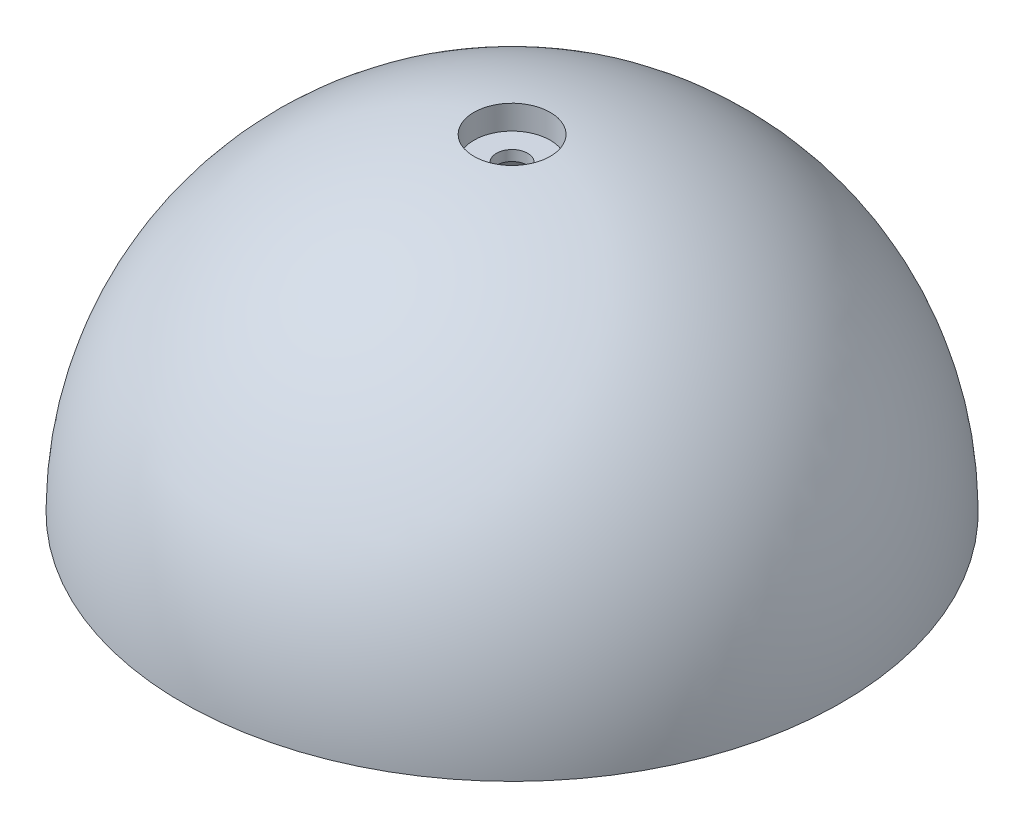
from build123d import *

# Parameters (mm, degrees)
SKETCH2_W              = 242.645613954
SKETCH2_H              = 231.138030636
CUT_IN_HALF_DEPTH      = 165.544826719
SKETCH3_R              = 11
BALLBEARINGHOLE_DEPTH  = 165.544826719
SKETCH4_R              = 31.202879122
SUPPORTFORHOLE_DEPTH   = 4
F_2NDBEARINGHOLE_START = -7
SKETCH5_R              = 11
F_2NDBEARINGHOLE_DEPTH = 7
SKETCH6_R              = 4.5
INSIDEHOLE_DEPTH       = 161.277134988


with BuildPart() as part:
    # Half Circle → Sphere Revolve (revolve)
    with BuildSketch(Plane.XY):
        with BuildLine():
            Line((0, 85), (0, 95))
            ThreePointArc((0, 95), (-95, 0), (0, -95))
            Line((0, -95), (0, -85))
            ThreePointArc((0, -85), (-85, 0), (0, 85))
        make_face()
    revolve(axis=Axis((0, 85, 0), (0, 1, 0)))

    # Sketch2 → Cut in Half (cut, through all)
    with BuildSketch(Plane(origin=(0, 0, 0), x_dir=(1, 0, 0), z_dir=(0, 1, 0))):
        Rectangle(SKETCH2_W, SKETCH2_H)
    extrude(amount=-CUT_IN_HALF_DEPTH, mode=Mode.SUBTRACT)

    # Sketch3 → BallBearingHole (cut, through all)
    with BuildSketch(Plane(origin=(0, 0, 0), x_dir=(1, 0, 0), z_dir=(0, 1, 0))):
        with Locations(Location((0, 0, 0), (0, 0, 90))):
            Circle(SKETCH3_R)
    extrude(amount=BALLBEARINGHOLE_DEPTH, mode=Mode.SUBTRACT)

    # Sketch4 → SupportForHole (add)
    with BuildSketch(Plane(origin=(0, 84.4, 0), x_dir=(1, 0, 0), z_dir=(0, 1, 0))):
        Circle(SKETCH4_R)
    extrude(amount=SUPPORTFORHOLE_DEPTH)

    # Sketch5 → 2ndBearingHole (cut)
    with BuildSketch(Plane(origin=(0, 94.4, 0), x_dir=(1, 0, 0), z_dir=(0, 1, 0)).offset(F_2NDBEARINGHOLE_START)):
        with Locations(Location((0, 0, 0), (0, 0, 90))):
            Circle(SKETCH5_R)
    extrude(amount=F_2NDBEARINGHOLE_DEPTH, mode=Mode.SUBTRACT)

    # Sketch6 → InsideHole (cut, through all)
    with BuildSketch(Plane(origin=(0, 87.4, 0), x_dir=(1, 0, 0), z_dir=(0, 1, 0))):
        with Locations(Location((0, 0, 0), (0, 0, 270))):
            Circle(SKETCH6_R)
    extrude(amount=-INSIDEHOLE_DEPTH, mode=Mode.SUBTRACT)


solid = part.part
